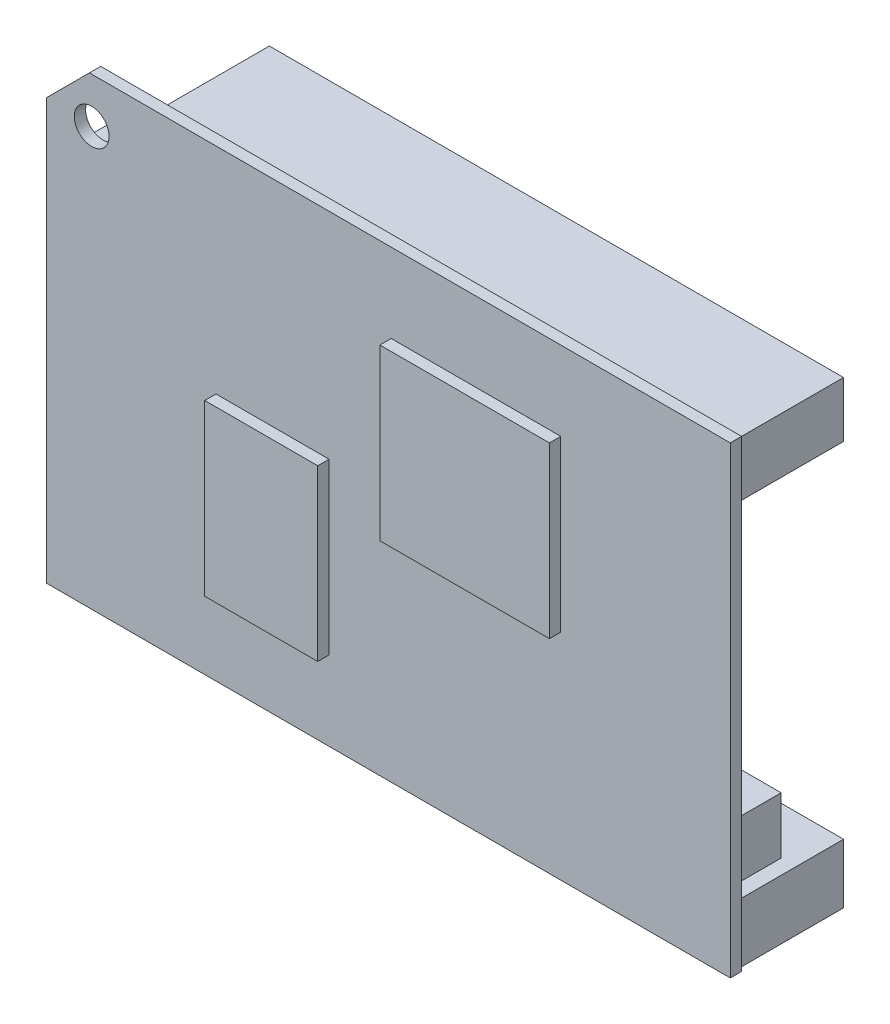
from build123d import *

# Parameters (mm, degrees)
SKETCH1_R            = 1.54
BOSS_EXTRUDE1_DEPTH  = 1
SKETCH2_W            = 15
SKETCH2_H            = 15
BOSS_EXTRUDE2_DEPTH  = 2
SKETCH3_W            = 10
SKETCH3_H            = 15
BOSS_EXTRUDE3_DEPTH  = 2
SKETCH4_W            = 50.8
SKETCH4_H            = 5.26
SKETCH4_H_2          = 4.9
BOSS_EXTRUDE4_DEPTH  = 9.2
SKETCH5_W            = 14.5
SKETCH5_H            = 12
BOSS_EXTRUDE6_DEPTH  = 7
SKETCH6_W            = 12
SKETCH6_H            = 5
BOSS_EXTRUDE7_DEPTH  = 5
SKETCH7_R            = 2.25
BOSS_EXTRUDE8_DEPTH  = 2
SKETCH8_W            = 6
SKETCH8_H            = 6.92
BOSS_EXTRUDE9_DEPTH  = 4
SKETCH9_W            = 6
SKETCH9_H            = 5
BOSS_EXTRUDE10_DEPTH = 4
SKETCH10_W           = 12
SKETCH10_H           = 18.48
BOSS_EXTRUDE11_DEPTH = 1
SKETCH11_W           = 12
SKETCH11_H           = 12
BOSS_EXTRUDE12_DEPTH = 1
SKETCH12_W           = 4
SKETCH12_H           = 4
BOSS_EXTRUDE13_DEPTH = 1
SKETCH13_W           = 2
SKETCH13_H           = 5
BOSS_EXTRUDE14_DEPTH = 0.5
SKETCH14_R           = 0.75
BOSS_EXTRUDE15_DEPTH = 0.5


with BuildPart() as part:
    # Sketch1 → Boss-Extrude1 (new body)
    with BuildSketch(Plane.XY):
        Polygon((0, 0), (-56.7, 0), (-60.5, -3.8), (-60.5, -41), (0, -41), align=None)
        with Locations((-56.5, -4)):
            Circle(SKETCH1_R, mode=Mode.SUBTRACT)
    extrude(amount=BOSS_EXTRUDE1_DEPTH)

    # Sketch2 → Boss-Extrude2 (add)
    with BuildSketch(Plane(origin=(0, 0, 0), x_dir=(-1, 0, 0), z_dir=(0, 0, -1))):
        with Locations((22.5, -14.5)):
            Rectangle(SKETCH2_W, SKETCH2_H)
    extrude(amount=-BOSS_EXTRUDE2_DEPTH)

    # Sketch3 → Boss-Extrude3 (add)
    with BuildSketch(Plane(origin=(0, 0, 0), x_dir=(-1, 0, 0), z_dir=(0, 0, -1))):
        with Locations((40.5, -26.5)):
            Rectangle(SKETCH3_W, SKETCH3_H)
    extrude(amount=-BOSS_EXTRUDE3_DEPTH)

    # Sketch4 → Boss-Extrude4 (add)
    with BuildSketch(Plane(origin=(0, 0, 0), x_dir=(-1, 0, 0), z_dir=(0, 0, -1))):
        with Locations((25.58, -38.19)):
            Rectangle(SKETCH4_W, SKETCH4_H)
        with Locations((25.58, -2.63)):
            Rectangle(SKETCH4_W, SKETCH4_H_2)
    extrude(amount=BOSS_EXTRUDE4_DEPTH)

    # Sketch5 → Boss-Extrude6 (add)
    with BuildSketch(Plane(origin=(0, 0, 0), x_dir=(-1, 0, 0), z_dir=(0, 0, -1))):
        with Locations((52.75, -14.08)):
            Rectangle(SKETCH5_W, SKETCH5_H)
    extrude(amount=BOSS_EXTRUDE6_DEPTH)

    # Sketch6 → Boss-Extrude7 (add)
    with BuildSketch(Plane(origin=(0, 0, 0), x_dir=(-1, 0, 0), z_dir=(0, 0, -1))):
        with Locations((51.5, -25.58)):
            Rectangle(SKETCH6_W, SKETCH6_H)
    extrude(amount=BOSS_EXTRUDE7_DEPTH)

    # Sketch7 → Boss-Extrude8 (add)
    with BuildSketch(Plane.ZY.offset(57.5)):
        with Locations(Location((-2.5, -25.58, 0), (0, 0, 180))):
            Circle(SKETCH7_R)
    extrude(amount=BOSS_EXTRUDE8_DEPTH)

    # Sketch8 → Boss-Extrude9 (add)
    with BuildSketch(Plane(origin=(0, 0, 0), x_dir=(-1, 0, 0), z_dir=(0, 0, -1))):
        with Locations((57, -36.54)):
            Rectangle(SKETCH8_W, SKETCH8_H)
    extrude(amount=BOSS_EXTRUDE9_DEPTH)

    # Sketch9 → Boss-Extrude10 (add)
    with BuildSketch(Plane(origin=(0, 0, 0), x_dir=(-1, 0, 0), z_dir=(0, 0, -1))):
        with Locations((3.5, -32.06)):
            Rectangle(SKETCH9_W, SKETCH9_H)
    extrude(amount=BOSS_EXTRUDE10_DEPTH)

    # Sketch10 → Boss-Extrude11 (add)
    with BuildSketch(Plane(origin=(0, 0, 0), x_dir=(-1, 0, 0), z_dir=(0, 0, -1))):
        with Locations((26, -19.32)):
            Rectangle(SKETCH10_W, SKETCH10_H)
    extrude(amount=BOSS_EXTRUDE11_DEPTH)

    # Sketch11 → Boss-Extrude12 (add)
    with BuildSketch(Plane(origin=(0, 0, 0), x_dir=(-1, 0, 0), z_dir=(0, 0, -1))):
        with Locations((10, -12.08)):
            Rectangle(SKETCH11_W, SKETCH11_H)
    extrude(amount=BOSS_EXTRUDE12_DEPTH)

    # Sketch12 → Boss-Extrude13 (add)
    with BuildSketch(Plane(origin=(0, 0, -1), x_dir=(-1, 0, 0), z_dir=(0, 0, -1))):
        with Locations((10, -11.08)):
            Rectangle(SKETCH12_W, SKETCH12_H)
    extrude(amount=BOSS_EXTRUDE13_DEPTH)

    # Sketch13 → Boss-Extrude14 (add)
    with BuildSketch(Plane(origin=(0, 0, 0), x_dir=(-1, 0, 0), z_dir=(0, 0, -1))):
        with Locations((2, -8.58)):
            Rectangle(SKETCH13_W, SKETCH13_H)
    extrude(amount=BOSS_EXTRUDE14_DEPTH)

    # Sketch14 → Boss-Extrude15 (add)
    with BuildSketch(Plane(origin=(0, 0, -0.5), x_dir=(-1, 0, 0), z_dir=(0, 0, -1))):
        with Locations(Location((2.037351084, -8.580279036, 0), (0, 0, 180))):
            Circle(SKETCH14_R)
    extrude(amount=BOSS_EXTRUDE15_DEPTH)


solid = part.part
